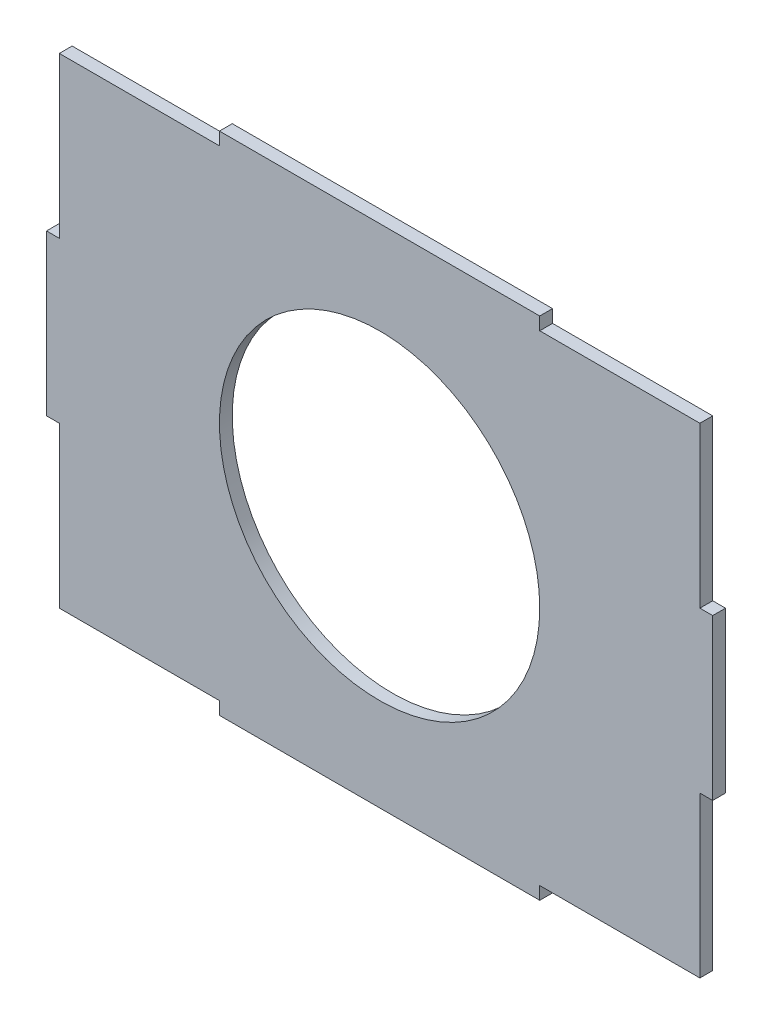
from build123d import *

# Parameters (mm, degrees)
SKETCH1_R           = 50
BOSS_EXTRUDE1_DEPTH = 4


with BuildPart() as part:
    # Sketch1 → Boss-Extrude1 (new body)
    with BuildSketch(Plane.XY):
        Polygon((0, 0), (100, 0), (100, 4), (150, 4), (150, 54), (154, 54), (154, 104), (150, 104), (150, 154), (100, 154), (100, 158), (0, 158), (0, 154), (-50, 154), (-50, 104), (-54, 104), (-54, 54), (-50, 54), (-50, 4), (0, 4), align=None)
        with Locations((50, 79)):
            Circle(SKETCH1_R, mode=Mode.SUBTRACT)
    extrude(amount=BOSS_EXTRUDE1_DEPTH)


solid = part.part
